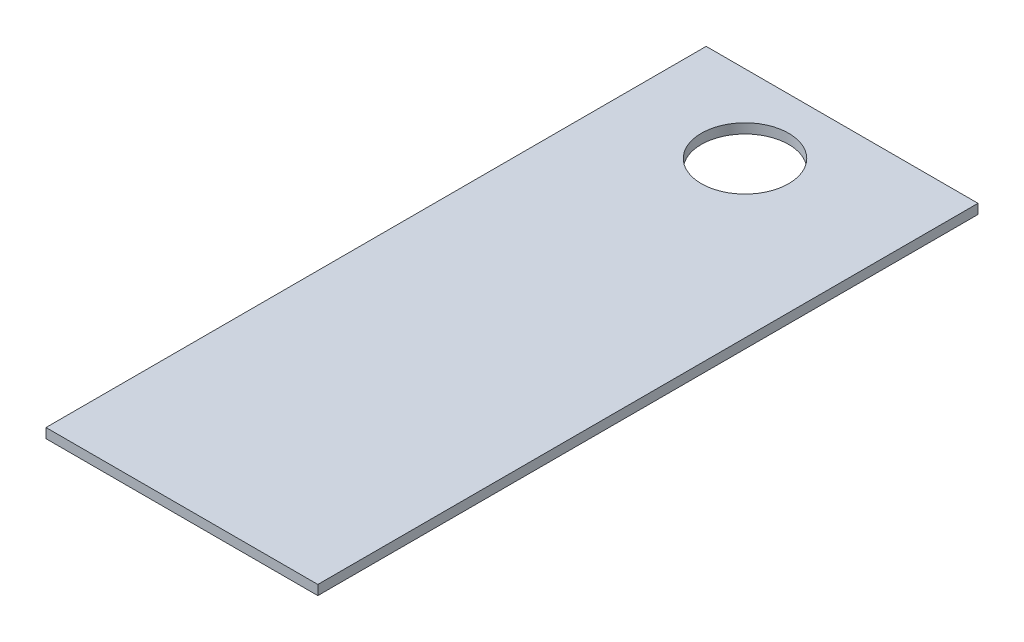
from build123d import *

# Parameters (mm, degrees)
SKETCH1_W           = 88.9
SKETCH1_H           = 215.9
SKETCH1_R           = 14.2875
BOSS_EXTRUDE1_DEPTH = 3.175


with BuildPart() as part:
    # Sketch1 → Boss-Extrude1 (new body)
    with BuildSketch(Plane(origin=(0, 0, 0), x_dir=(1, 0, 0), z_dir=(0, 1, 0))):
        Rectangle(SKETCH1_W, SKETCH1_H)
        with Locations(Location((-6.35, 82.55, 0), (0, 0, 270))):
            Circle(SKETCH1_R, mode=Mode.SUBTRACT)
    extrude(amount=BOSS_EXTRUDE1_DEPTH)


solid = part.part
